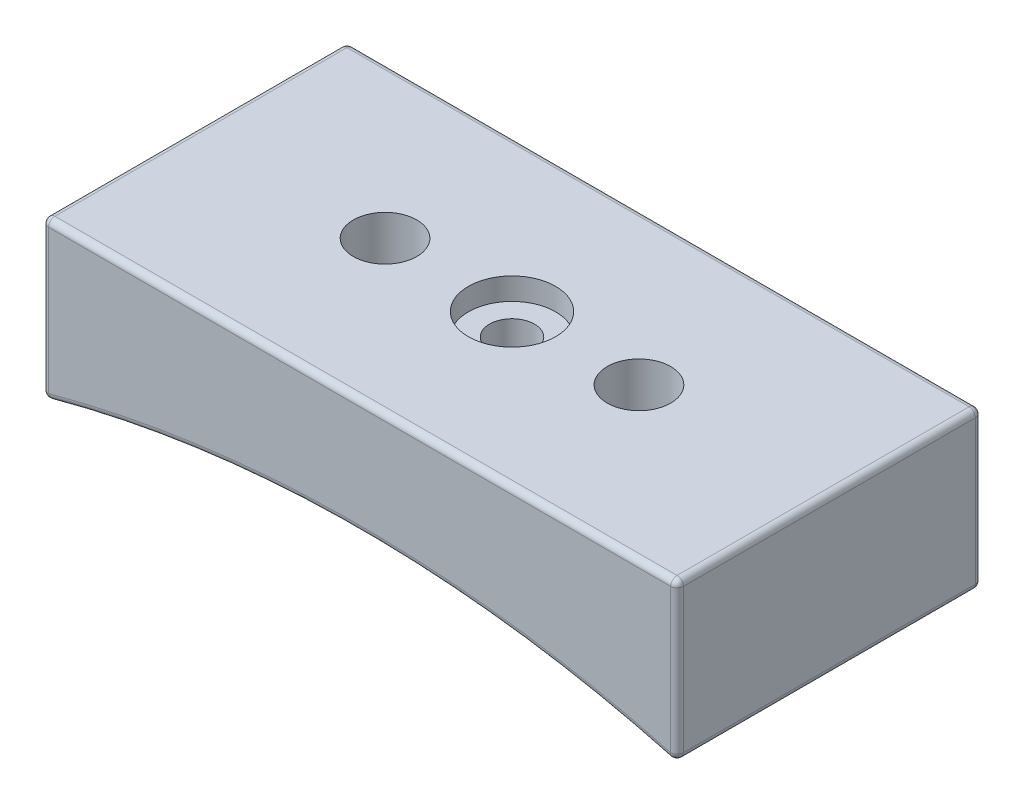
from build123d import *

# Parameters (mm, degrees)
BOSS_EXTRUDE1_DEPTH                            = 30.48
CBORE_FOR_8_BUTTON_HEAD_CAP_SCREW1_D           = 4.4958
CBORE_FOR_8_BUTTON_HEAD_CAP_SCREW1_CBORE_D     = 8.73252
CBORE_FOR_8_BUTTON_HEAD_CAP_SCREW1_CBORE_DEPTH = 2.2098
CUT_EXTRUDE1_DEPTH                             = 46.498222856
CUT_EXTRUDE1_DEPTH_BACK                        = 46.498222856
SKETCH6_R                                      = 3.175
CUT_EXTRUDE2_DEPTH                             = 46.498222856
CUT_EXTRUDE2_DEPTH_BACK                        = 5.588
SKETCH7_R                                      = 8.128
FILLET1_R                                      = 0.635


with BuildPart() as part:
    # Sketch1 → Boss-Extrude1 (new body)
    with BuildSketch(Plane.XY):
        with BuildLine():
            Line((-31.75, 12.7), (31.75, 12.7))
            Line((31.75, 12.7), (31.75, -3.175))
            ThreePointArc((31.75, -3.175), (0, 1.167638116), (-31.75, -3.175))
            Line((-31.75, -3.175), (-31.75, 12.7))
        make_face()
    extrude(amount=BOSS_EXTRUDE1_DEPTH)

    # CBORE for #8 Button Head Cap Screw1 (through all)
    with Locations(Plane(origin=(0, 12.7, 0), x_dir=(1, 0, 0), z_dir=(0, 1, 0))):
        with Locations((0, -15.24)):
            CounterBoreHole(CBORE_FOR_8_BUTTON_HEAD_CAP_SCREW1_D / 2, CBORE_FOR_8_BUTTON_HEAD_CAP_SCREW1_CBORE_D / 2, CBORE_FOR_8_BUTTON_HEAD_CAP_SCREW1_CBORE_DEPTH)

    # Sketch6 → Cut-Extrude1 (cut, two sides: drawn at the far end of the back side and taken through both)
    with BuildSketch(Plane(origin=(0, 1.167638116, 0), x_dir=(-1, 0, 0), z_dir=(0, -1, 0)).offset(-CUT_EXTRUDE1_DEPTH_BACK)):
        with Locations(Location((12.7, -15.24, 0), (0, 0, 90))):
            Circle(SKETCH6_R)
        with Locations(Location((-12.7, -15.24, 0), (0, 0, 90))):
            Circle(SKETCH6_R)
    extrude(amount=CUT_EXTRUDE1_DEPTH + CUT_EXTRUDE1_DEPTH_BACK, mode=Mode.SUBTRACT)

    # Sketch7 → Cut-Extrude2 (cut, two sides: drawn at the far end of the back side and taken through both)
    with BuildSketch(Plane(origin=(0, 1.167638116, 0), x_dir=(-1, 0, 0), z_dir=(0, -1, 0)).offset(-CUT_EXTRUDE2_DEPTH_BACK)):
        with Locations(Location((12.7, -15.24, 0), (0, 0, 270))):
            Circle(SKETCH7_R)
        with Locations(Location((-12.7, -15.24, 0), (0, 0, 270))):
            Circle(SKETCH7_R)
    extrude(amount=CUT_EXTRUDE2_DEPTH + CUT_EXTRUDE2_DEPTH_BACK, mode=Mode.SUBTRACT)

    # Fillet1
    fillet1_edges = [part.edges().sort_by_distance(p)[0] for p in [
        (0, 12.7, 30.48),
        (-31.75, 4.7625, 30.48),
        (0, 1.167638116, 30.48),
        (-31.75, 4.7625, 0),
        (0, 12.7, 0),
        (31.75, 4.7625, 0),
        (0, 1.167638116, 0),
        (31.75, 4.7625, 30.48),
        (-31.75, -3.175, 15.24),
        (-31.75, 12.7, 15.24),
        (31.75, 12.7, 15.24),
        (31.75, -3.175, 15.24),
    ]]
    fillet(fillet1_edges, radius=FILLET1_R)


solid = part.part
